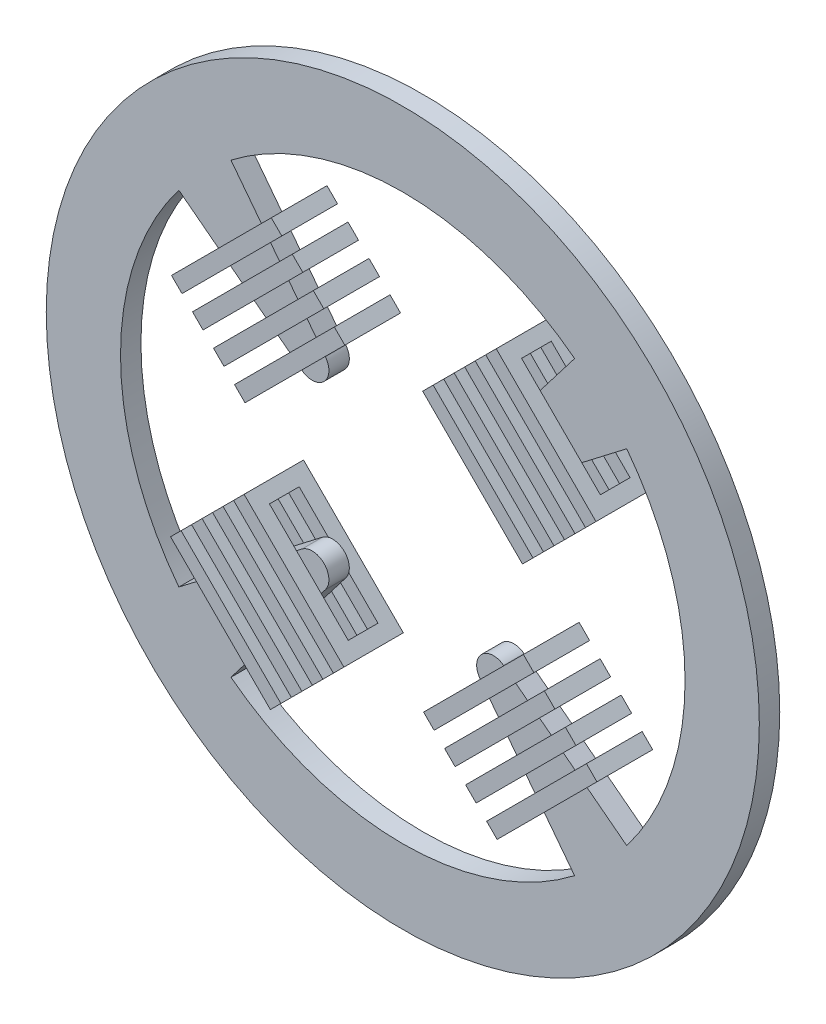
from build123d import *

# Parameters (mm, degrees)
SKETCH_1_R          = 0.96
SKETCH_1_R_2        = 0.76
EXTRUDE_1_DEPTH     = 0.055
EXTRUDE_START       = -0.055
EXTRUDE_2_DEPTH     = 0.055
SKETCH_11_W         = 0.38
SKETCH_11_H         = 0.16
SKETCH_11_W_2       = 0.3
SKETCH_11_H_2       = 0.08
EXTRUDE_3_DEPTH     = 0.04
EXTRUDE_28_DEPTH    = 0.04
SKETCH_64_W         = 0.15
SKETCH_64_H         = 0.38
SKETCH_64_W_2       = 0.07
SKETCH_64_H_2       = 0.3
EXTRUDE_29_DEPTH    = 0.04
SKETCH_68_W         = 0.15
SKETCH_68_H         = 0.38
SKETCH_68_W_2       = 0.07
SKETCH_68_H_2       = 0.3
EXTRUDE_30_DEPTH    = 0.04
SKETCH_69_W         = 0.15
SKETCH_69_H         = 0.38
SKETCH_69_W_2       = 0.07
SKETCH_69_H_2       = 0.3
EXTRUDE_31_DEPTH    = 0.04
SKETCH_70_W         = 0.15
SKETCH_70_H         = 0.38
SKETCH_70_W_2       = 0.07
SKETCH_70_H_2       = 0.3
EXTRUDE_32_DEPTH    = 0.04
SKETCH_71_W         = 0.15
SKETCH_71_H         = 0.38
SKETCH_71_W_2       = 0.07
SKETCH_71_H_2       = 0.3
EXTRUDE_33_DEPTH    = 0.04
SKETCH_72_W         = 0.15
SKETCH_72_H         = 0.38
SKETCH_72_W_2       = 0.07
SKETCH_72_H_2       = 0.3
EXTRUDE_34_DEPTH    = 0.04
SKETCH_73_W         = 0.15
SKETCH_73_H         = 0.38
SKETCH_73_W_2       = 0.07
SKETCH_73_H_2       = 0.3
EXTRUDE_35_DEPTH    = 0.04
SKETCH_76_W         = 0.38
SKETCH_76_H         = 0.16
SKETCH_76_W_2       = 0.3
SKETCH_76_H_2       = 0.08
EXTRUDE_36_DEPTH    = 0.04
SKETCH_77_W         = 0.38
SKETCH_77_H         = 0.16
SKETCH_77_W_2       = 0.3
SKETCH_77_H_2       = 0.08
EXTRUDE_37_DEPTH    = 0.04
SKETCH_78_W         = 0.38
SKETCH_78_H         = 0.16
SKETCH_78_W_2       = 0.3
SKETCH_78_H_2       = 0.08
EXTRUDE_38_DEPTH    = 0.04
SKETCH_79_W         = 0.38
SKETCH_79_H         = 0.16
SKETCH_79_W_2       = 0.3
SKETCH_79_H_2       = 0.08
EXTRUDE_39_DEPTH    = 0.04
SKETCH_80_W         = 0.38
SKETCH_80_H         = 0.16
SKETCH_80_W_2       = 0.3
SKETCH_80_H_2       = 0.08
EXTRUDE_40_DEPTH    = 0.04
SKETCH_81_W         = 0.38
SKETCH_81_H         = 0.16
SKETCH_81_W_2       = 0.3
SKETCH_81_H_2       = 0.08
EXTRUDE_41_DEPTH    = 0.04
SKETCH_82_W         = 0.38
SKETCH_82_H         = 0.16
SKETCH_82_W_2       = 0.3
SKETCH_82_H_2       = 0.08
EXTRUDE_42_DEPTH    = 0.04
SKETCH_86_W         = 0.04
SKETCH_86_H         = 0.017980016
CUT_EXTRUDE_4_DEPTH = 0.5


with BuildPart() as part:
    # 草圖1 → 填料-伸長1 (new body)
    with BuildSketch(Plane.XY):
        Circle(SKETCH_1_R)
        Circle(SKETCH_1_R_2, mode=Mode.SUBTRACT)
    extrude(amount=EXTRUDE_1_DEPTH)

    # 草圖2 → 填料-伸長2 (add)
    with BuildSketch(Plane.XY.offset(0.055).offset(EXTRUDE_START)):
        with BuildLine():
            Line((-0.208247811, 0.271393831), (-0.462658686, 0.602948539))
            ThreePointArc((-0.462658686, 0.602948539), (-0.537401154, 0.537401154), (-0.602948539, 0.462658686))
            Line((-0.602948539, 0.462658686), (-0.271393831, 0.208247811))
            ThreePointArc((-0.271393831, 0.208247811), (-0.241031974, 0.199037642), (-0.212132034, 0.212132034))
            ThreePointArc((-0.212132034, 0.212132034), (-0.199037642, 0.241031974), (-0.208247811, 0.271393831))
        make_face()
        with BuildLine():
            ThreePointArc((0.208247811, 0.271393831), (0.199037642, 0.241031974), (0.212132034, 0.212132034))
            ThreePointArc((0.212132034, 0.212132034), (0.241031974, 0.199037642), (0.271393831, 0.208247811))
            Line((0.271393831, 0.208247811), (0.602948539, 0.462658686))
            ThreePointArc((0.602948539, 0.462658686), (0.537401154, 0.537401154), (0.462658686, 0.602948539))
            Line((0.462658686, 0.602948539), (0.208247811, 0.271393831))
        make_face()
        with BuildLine():
            ThreePointArc((0.271393831, -0.208247811), (0.241031974, -0.199037642), (0.212132034, -0.212132034))
            ThreePointArc((0.212132034, -0.212132034), (0.199037642, -0.241031974), (0.208247811, -0.271393831))
            Line((0.208247811, -0.271393831), (0.462658686, -0.602948539))
            ThreePointArc((0.462658686, -0.602948539), (0.537401154, -0.537401154), (0.602948539, -0.462658686))
            Line((0.602948539, -0.462658686), (0.271393831, -0.208247811))
        make_face()
        with BuildLine():
            ThreePointArc((-0.208247811, -0.271393831), (-0.199037642, -0.241031974), (-0.212132034, -0.212132034))
            ThreePointArc((-0.212132034, -0.212132034), (-0.241031974, -0.199037642), (-0.271393831, -0.208247811))
            Line((-0.271393831, -0.208247811), (-0.602948539, -0.462658686))
            ThreePointArc((-0.602948539, -0.462658686), (-0.537401154, -0.537401154), (-0.462658686, -0.602948539))
            Line((-0.462658686, -0.602948539), (-0.208247811, -0.271393831))
        make_face()
    extrude(amount=EXTRUDE_2_DEPTH)


with BuildPart() as body_2:
    # 草圖11 → 填料-伸長3 (new body)
    with BuildSketch(Plane(origin=(0.240416306, 0.240416306, 0), x_dir=(-0.7071067811865476, 0.7071067811865476, 0), z_dir=(0.7071067811865476, 0.7071067811865476, 0))):
        with Locations((0, 0.0275)):
            Rectangle(SKETCH_11_W, SKETCH_11_H)
        with Locations((0, 0.0275)):
            Rectangle(SKETCH_11_W_2, SKETCH_11_H_2, mode=Mode.SUBTRACT)
    extrude(amount=EXTRUDE_3_DEPTH)


with BuildPart() as body_3:
    # 草圖62 → 填料-伸長28 (new body)
    with BuildSketch(Plane(origin=(0.240416306, -0.240416306, 0), x_dir=(0.7071067811865477, 0.7071067811865475, 0), z_dir=(0.7071067811865475, -0.7071067811865477, 0))):
        Polygon((0, -0.005), (0, -0.045), (0.19, -0.045), (0.19, 0.105), (0, 0.105), (0, 0.065), (0.15, 0.065), (0.15, -0.005), align=None)
        Polygon((-0.19, -0.045), (0, -0.045), (0, -0.005), (-0.15, -0.005), (-0.15, 0.065), (0, 0.065), (0, 0.105), (-0.19, 0.105), align=None)
    extrude(amount=EXTRUDE_28_DEPTH)


with BuildPart() as body_4:
    # 草圖64 → 填料-伸長29 (new body)
    with BuildSketch(Plane(origin=(0.296984848, -0.296984848, 0), x_dir=(0, 0, -1), z_dir=(0.7071067811865487, -0.7071067811865464, 0))):
        with Locations((-0.03, 0)):
            Rectangle(SKETCH_64_W, SKETCH_64_H)
        with Locations((-0.03, 0)):
            Rectangle(SKETCH_64_W_2, SKETCH_64_H_2, mode=Mode.SUBTRACT)
    extrude(amount=EXTRUDE_29_DEPTH)


with BuildPart() as body_5:
    # 草圖68 → 填料-伸長30 (new body)
    with BuildSketch(Plane(origin=(0.353553391, -0.353553391, 0), x_dir=(0, 0, -1), z_dir=(0.7071067811865487, -0.7071067811865464, 0))):
        with Locations((-0.03, 0)):
            Rectangle(SKETCH_68_W, SKETCH_68_H)
        with Locations((-0.03, 0)):
            Rectangle(SKETCH_68_W_2, SKETCH_68_H_2, mode=Mode.SUBTRACT)
    extrude(amount=EXTRUDE_30_DEPTH)


with BuildPart() as body_6:
    # 草圖69 → 填料-伸長31 (new body)
    with BuildSketch(Plane(origin=(0.410121933, -0.410121933, 0), x_dir=(0, 0, -1), z_dir=(0.7071067811865487, -0.7071067811865464, 0))):
        with Locations((-0.03, 0)):
            Rectangle(SKETCH_69_W, SKETCH_69_H)
        with Locations((-0.03, 0)):
            Rectangle(SKETCH_69_W_2, SKETCH_69_H_2, mode=Mode.SUBTRACT)
    extrude(amount=EXTRUDE_31_DEPTH)


with BuildPart() as body_7:
    # 草圖70 → 填料-伸長32 (new body)
    with BuildSketch(Plane(origin=(-0.240416306, 0.240416306, 0), x_dir=(0, 0, -1), z_dir=(0.7071067811865487, -0.7071067811865464, 0))):
        with Locations((-0.03, 0)):
            Rectangle(SKETCH_70_W, SKETCH_70_H)
        with Locations((-0.03, 0)):
            Rectangle(SKETCH_70_W_2, SKETCH_70_H_2, mode=Mode.SUBTRACT)
    extrude(amount=-EXTRUDE_32_DEPTH)


with BuildPart() as body_8:
    # 草圖71 → 填料-伸長33 (new body)
    with BuildSketch(Plane(origin=(-0.296984848, 0.296984848, 0), x_dir=(0, 0, -1), z_dir=(0.7071067811865487, -0.7071067811865464, 0))):
        with Locations((-0.03, 0)):
            Rectangle(SKETCH_71_W, SKETCH_71_H)
        with Locations((-0.03, 0)):
            Rectangle(SKETCH_71_W_2, SKETCH_71_H_2, mode=Mode.SUBTRACT)
    extrude(amount=-EXTRUDE_33_DEPTH)


with BuildPart() as body_9:
    # 草圖72 → 填料-伸長34 (new body)
    with BuildSketch(Plane(origin=(-0.353553391, 0.353553391, 0), x_dir=(0, 0, -1), z_dir=(0.7071067811865487, -0.7071067811865464, 0))):
        with Locations((-0.03, 0)):
            Rectangle(SKETCH_72_W, SKETCH_72_H)
        with Locations((-0.03, 0)):
            Rectangle(SKETCH_72_W_2, SKETCH_72_H_2, mode=Mode.SUBTRACT)
    extrude(amount=-EXTRUDE_34_DEPTH)


with BuildPart() as body_10:
    # 草圖73 → 填料-伸長35 (new body)
    with BuildSketch(Plane(origin=(-0.410121933, 0.410121933, 0), x_dir=(0, 0, -1), z_dir=(0.7071067811865487, -0.7071067811865464, 0))):
        with Locations((-0.03, 0)):
            Rectangle(SKETCH_73_W, SKETCH_73_H)
        with Locations((-0.03, 0)):
            Rectangle(SKETCH_73_W_2, SKETCH_73_H_2, mode=Mode.SUBTRACT)
    extrude(amount=-EXTRUDE_35_DEPTH)


with BuildPart() as body_11:
    # 草圖76 → 填料-伸長36 (new body)
    with BuildSketch(Plane(origin=(0.296984848, 0.296984848, 0), x_dir=(0.7071067811865515, -0.7071067811865436, 0), z_dir=(0.7071067811865436, 0.7071067811865515, 0))):
        with Locations((0, -0.0275)):
            Rectangle(SKETCH_76_W, SKETCH_76_H)
        with Locations((0, -0.0275)):
            Rectangle(SKETCH_76_W_2, SKETCH_76_H_2, mode=Mode.SUBTRACT)
    extrude(amount=EXTRUDE_36_DEPTH)


with BuildPart() as body_12:
    # 草圖77 → 填料-伸長37 (new body)
    with BuildSketch(Plane(origin=(0.353553391, 0.353553391, 0), x_dir=(0.7071067811865515, -0.7071067811865436, 0), z_dir=(0.7071067811865436, 0.7071067811865515, 0))):
        with Locations((0, -0.0275)):
            Rectangle(SKETCH_77_W, SKETCH_77_H)
        with Locations((0, -0.0275)):
            Rectangle(SKETCH_77_W_2, SKETCH_77_H_2, mode=Mode.SUBTRACT)
    extrude(amount=EXTRUDE_37_DEPTH)


with BuildPart() as body_13:
    # 草圖78 → 填料-伸長38 (new body)
    with BuildSketch(Plane(origin=(0.410121933, 0.410121933, 0), x_dir=(0.7071067811865515, -0.7071067811865436, 0), z_dir=(0.7071067811865436, 0.7071067811865515, 0))):
        with Locations((0, -0.0275)):
            Rectangle(SKETCH_78_W, SKETCH_78_H)
        with Locations((0, -0.0275)):
            Rectangle(SKETCH_78_W_2, SKETCH_78_H_2, mode=Mode.SUBTRACT)
    extrude(amount=EXTRUDE_38_DEPTH)


with BuildPart() as body_14:
    # 草圖79 → 填料-伸長39 (new body)
    with BuildSketch(Plane(origin=(-0.240416306, -0.240416306, 0), x_dir=(0.7071067811865515, -0.7071067811865436, 0), z_dir=(0.7071067811865436, 0.7071067811865515, 0))):
        with Locations((0, -0.0275)):
            Rectangle(SKETCH_79_W, SKETCH_79_H)
        with Locations((0, -0.0275)):
            Rectangle(SKETCH_79_W_2, SKETCH_79_H_2, mode=Mode.SUBTRACT)
    extrude(amount=-EXTRUDE_39_DEPTH)


with BuildPart() as body_15:
    # 草圖80 → 填料-伸長40 (new body)
    with BuildSketch(Plane(origin=(-0.296984848, -0.296984848, 0), x_dir=(0.7071067811865515, -0.7071067811865436, 0), z_dir=(0.7071067811865436, 0.7071067811865515, 0))):
        with Locations((0, -0.0275)):
            Rectangle(SKETCH_80_W, SKETCH_80_H)
        with Locations((0, -0.0275)):
            Rectangle(SKETCH_80_W_2, SKETCH_80_H_2, mode=Mode.SUBTRACT)
    extrude(amount=-EXTRUDE_40_DEPTH)


with BuildPart() as body_16:
    # 草圖81 → 填料-伸長41 (new body)
    with BuildSketch(Plane(origin=(-0.353553391, -0.353553391, 0), x_dir=(0.7071067811865515, -0.7071067811865436, 0), z_dir=(0.7071067811865436, 0.7071067811865515, 0))):
        with Locations((0, -0.0275)):
            Rectangle(SKETCH_81_W, SKETCH_81_H)
        with Locations((0, -0.0275)):
            Rectangle(SKETCH_81_W_2, SKETCH_81_H_2, mode=Mode.SUBTRACT)
    extrude(amount=-EXTRUDE_41_DEPTH)


with BuildPart() as body_17:
    # 草圖82 → 填料-伸長42 (new body)
    with BuildSketch(Plane(origin=(-0.410121933, -0.410121933, 0), x_dir=(0.7071067811865515, -0.7071067811865436, 0), z_dir=(0.7071067811865436, 0.7071067811865515, 0))):
        with Locations((0, -0.0275)):
            Rectangle(SKETCH_82_W, SKETCH_82_H)
        with Locations((0, -0.0275)):
            Rectangle(SKETCH_82_W_2, SKETCH_82_H_2, mode=Mode.SUBTRACT)
    extrude(amount=-EXTRUDE_42_DEPTH)


with BuildPart() as cut_extrude_4_tool:
    # 草圖86 → 除料-伸長4 (new body)
    with BuildSketch(Plane(origin=(0.438406204, 0.438406204, 0), x_dir=(0, 0, -1), z_dir=(0.7071067811865435, 0.7071067811865517, 0))):
        with Locations((0.0325, 0.008990008)):
            Rectangle(SKETCH_86_W, SKETCH_86_H)
    extrude(amount=-CUT_EXTRUDE_4_DEPTH)


with BuildPart() as body_2_1:
    add(body_2.part)

    # 除料-伸長4: cut by cut_extrude_4_tool
    add(cut_extrude_4_tool.part, mode=Mode.SUBTRACT)


with BuildPart() as body_11_1:
    add(body_11.part)

    # 除料-伸長4: cut by cut_extrude_4_tool
    add(cut_extrude_4_tool.part, mode=Mode.SUBTRACT)


with BuildPart() as body_12_1:
    add(body_12.part)

    # 除料-伸長4: cut by cut_extrude_4_tool
    add(cut_extrude_4_tool.part, mode=Mode.SUBTRACT)


with BuildPart() as body_13_1:
    add(body_13.part)

    # 除料-伸長4: cut by cut_extrude_4_tool
    add(cut_extrude_4_tool.part, mode=Mode.SUBTRACT)


solid = Compound([part.part, body_3.part, body_4.part, body_5.part, body_6.part, body_7.part, body_8.part, body_9.part, body_10.part, body_14.part, body_15.part, body_16.part, body_17.part, body_2_1.part, body_11_1.part, body_12_1.part, body_13_1.part])
